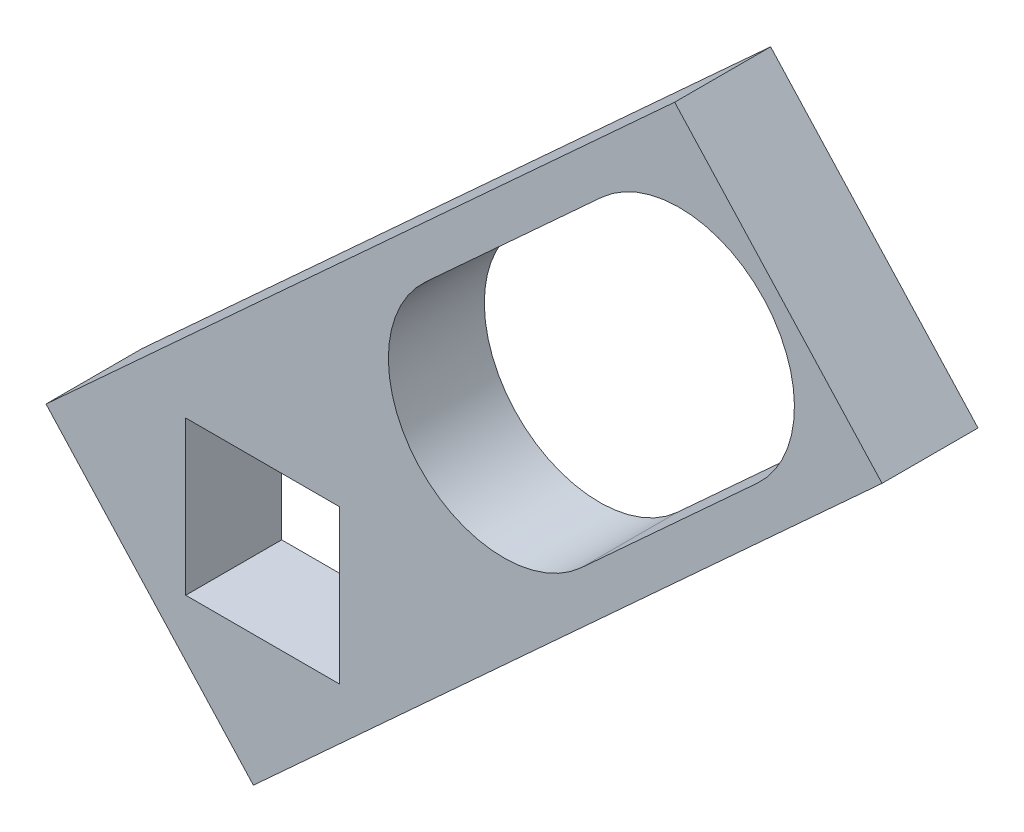
from build123d import *

# Parameters (mm, degrees)
BOSS_EXTRUDE1_DEPTH = 2.5
SKETCH2_W           = 4
SKETCH2_H           = 4
CUT_EXTRUDE1_DEPTH  = 27.670895226
CUT_EXTRUDE2_DEPTH  = 27.670895226


with BuildPart() as part:
    # Sketch1 → Boss-Extrude1 (new body)
    with BuildSketch(Plane.XY):
        Polygon((0, 0), (16.37938033, 15), (10.976408696, 20.899821821), (-5.402971634, 5.899821821), align=None)
    extrude(amount=BOSS_EXTRUDE1_DEPTH)

    # Sketch2 → Cut-Extrude1 (cut, through all)
    with BuildSketch(Plane.XY.offset(2.5)):
        with Locations((0.237599868, 5.405134804)):
            Rectangle(SKETCH2_W, SKETCH2_H)
    extrude(amount=-CUT_EXTRUDE1_DEPTH, mode=Mode.SUBTRACT)

    # Sketch3 → Cut-Extrude2 (cut, through all)
    with BuildSketch(Plane.XY.offset(2.5)):
        with BuildLine():
            Line((13.122836829, 13.373677638), (8.543100141, 9.179620906))
            ThreePointArc((8.543100141, 9.179620906), (4.304552595, 9.365939726), (4.490871415, 13.604487272))
            Line((4.490871415, 13.604487272), (9.070608103, 17.798544003))
            ThreePointArc((9.070608103, 17.798544003), (13.309155649, 17.612225183), (13.122836829, 13.373677638))
        make_face()
    extrude(amount=-CUT_EXTRUDE2_DEPTH, mode=Mode.SUBTRACT)


solid = part.part
